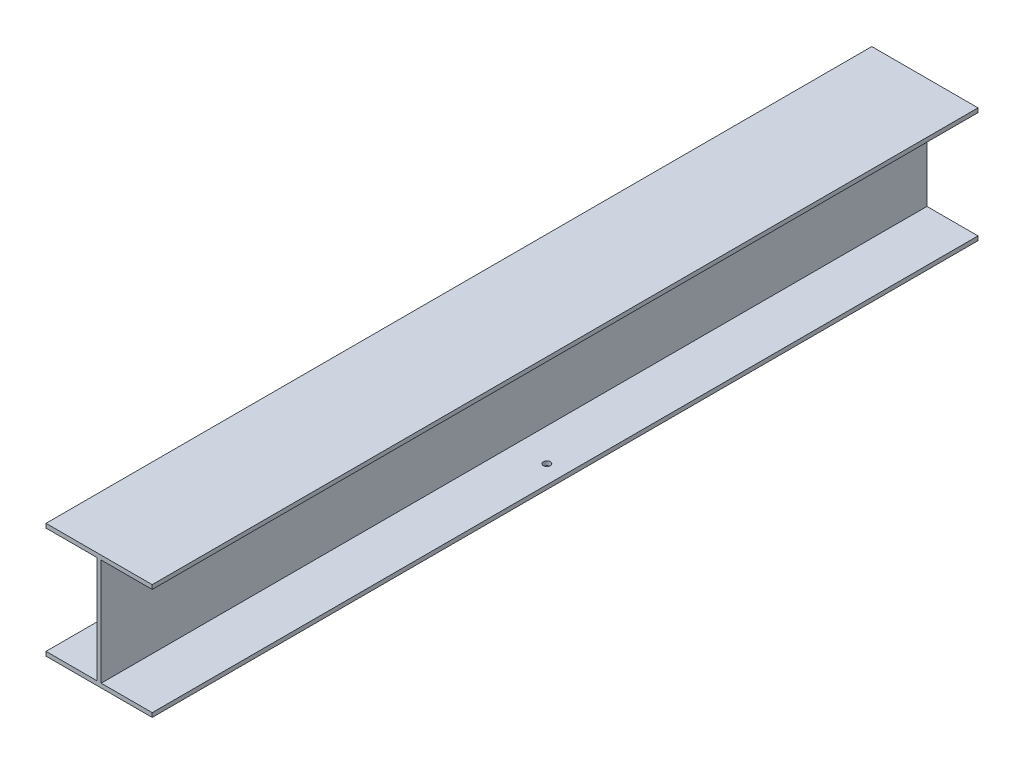
from build123d import *

# Parameters (mm, degrees)
BOSS_EXTRUDE1_DEPTH = 1185
SKETCH3_R           = 5
CUT_EXTRUDE2_DEPTH  = 20


with BuildPart() as part:
    # Sketch1 → Boss-Extrude1 (new body)
    with BuildSketch(Plane.XY):
        Polygon((76.2, 82.55), (-76.2, 82.55), (-76.2, 76.55), (-3, 76.55), (-3, -76.55), (-76.2, -76.55), (-76.2, -82.55), (76.2, -82.55), (76.2, -76.55), (3, -76.55), (3, 76.55), (76.2, 76.55), align=None)
    extrude(amount=BOSS_EXTRUDE1_DEPTH)

    # Sketch3 → Cut-Extrude2 (cut)
    with BuildSketch(Plane.XZ.offset(82.55)):
        with Locations((-50, 592.5)):
            Circle(SKETCH3_R)
        with Locations((50, 592.5)):
            Circle(SKETCH3_R)
    extrude(amount=-CUT_EXTRUDE2_DEPTH, mode=Mode.SUBTRACT)


solid = part.part
